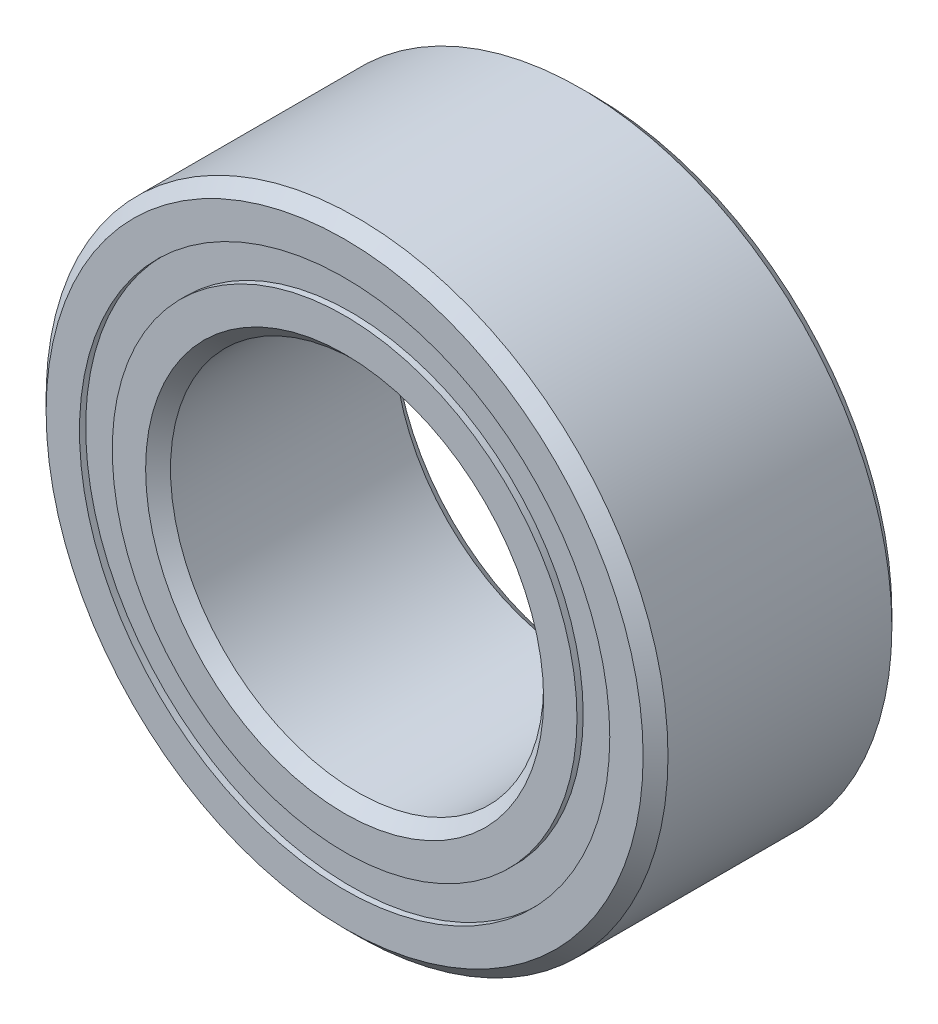
from build123d import *

# Parameters (mm, degrees)
CIRPATTERN1_COUNT = 12
SKETCH6_W         = 0.772168375
SKETCH6_H         = 0.418681318


with BuildPart() as part:
    # Sketch1 → Revolve1 (revolve)
    with BuildSketch(Plane(origin=(0, 0, 0), x_dir=(0, 0, -1), z_dir=(1, 0, 0))):
        with BuildLine():
            Line((1.42875, 3.96875), (-1.42875, 3.96875))
            Line((-1.42875, 3.96875), (-1.5875, 3.81))
            Line((-1.5875, 3.81), (-1.5875, 3.384340659))
            Line((-1.5875, 3.384340659), (-0.705555556, 3.384340659))
            ThreePointArc((-0.705555556, 3.384340659), (0, 3.910956625), (0.705555556, 3.384340659))
            Line((0.705555556, 3.384340659), (1.5875, 3.384340659))
            Line((1.5875, 3.384340659), (1.5875, 3.81))
            Line((1.5875, 3.81), (1.42875, 3.96875))
        make_face()
    revolve(axis=Axis((0, 0, 1.5875), (0, 0, -1)))


with BuildPart() as body_2:
    # Sketch3 → Revolve3 (revolve)
    with BuildSketch(Plane(origin=(0, 0, 0), x_dir=(0, 0, -1), z_dir=(1, 0, 0))):
        with BuildLine():
            Line((-1.5875, 2.965659341), (-0.705555556, 2.965659341))
            ThreePointArc((-0.705555556, 2.965659341), (0, 2.439043375), (0.705555556, 2.965659341))
            Line((0.705555556, 2.965659341), (1.5875, 2.965659341))
            Line((1.5875, 2.965659341), (1.5875, 2.54))
            Line((1.5875, 2.54), (1.42875, 2.38125))
            Line((1.42875, 2.38125), (-1.42875, 2.38125))
            Line((-1.42875, 2.38125), (-1.5875, 2.54))
            Line((-1.5875, 2.54), (-1.5875, 2.965659341))
        make_face()
    revolve(axis=Axis((0, 0, 1.5875), (0, 0, -1)))


with BuildPart() as body_3:
    # Sketch4 → Revolve4 (revolve)
    with BuildSketch(Plane(origin=(0, 0, 0), x_dir=(0, 0, -1), z_dir=(1, 0, 0))):
        with BuildLine():
            Line((-0.735956625, 3.175), (0.735956625, 3.175))
            ThreePointArc((0.735956625, 3.175), (0, 3.910956625), (-0.735956625, 3.175))
        make_face()
    revolve(axis=Axis((0, 3.175, 0.735956625), (0, 0, -1)))


with BuildPart() as cirpattern1_1:
    # CirPattern1: pattern copy
    add(body_3.part.rotate(Axis((0, 0, -1.5875), (0, 0, 1)), 1 * 360 / CIRPATTERN1_COUNT))


with BuildPart() as cirpattern1_2:
    # CirPattern1: pattern copy
    add(body_3.part.rotate(Axis((0, 0, -1.5875), (0, 0, 1)), 2 * 360 / CIRPATTERN1_COUNT))


with BuildPart() as cirpattern1_3:
    # CirPattern1: pattern copy
    add(body_3.part.rotate(Axis((0, 0, -1.5875), (0, 0, 1)), 3 * 360 / CIRPATTERN1_COUNT))


with BuildPart() as cirpattern1_4:
    # CirPattern1: pattern copy
    add(body_3.part.rotate(Axis((0, 0, -1.5875), (0, 0, 1)), 4 * 360 / CIRPATTERN1_COUNT))


with BuildPart() as cirpattern1_5:
    # CirPattern1: pattern copy
    add(body_3.part.rotate(Axis((0, 0, -1.5875), (0, 0, 1)), 5 * 360 / CIRPATTERN1_COUNT))


with BuildPart() as cirpattern1_6:
    # CirPattern1: pattern copy
    add(body_3.part.rotate(Axis((0, 0, -1.5875), (0, 0, 1)), 6 * 360 / CIRPATTERN1_COUNT))


with BuildPart() as cirpattern1_7:
    # CirPattern1: pattern copy
    add(body_3.part.rotate(Axis((0, 0, -1.5875), (0, 0, 1)), 7 * 360 / CIRPATTERN1_COUNT))


with BuildPart() as cirpattern1_8:
    # CirPattern1: pattern copy
    add(body_3.part.rotate(Axis((0, 0, -1.5875), (0, 0, 1)), 8 * 360 / CIRPATTERN1_COUNT))


with BuildPart() as cirpattern1_9:
    # CirPattern1: pattern copy
    add(body_3.part.rotate(Axis((0, 0, -1.5875), (0, 0, 1)), 9 * 360 / CIRPATTERN1_COUNT))


with BuildPart() as cirpattern1_10:
    # CirPattern1: pattern copy
    add(body_3.part.rotate(Axis((0, 0, -1.5875), (0, 0, 1)), 10 * 360 / CIRPATTERN1_COUNT))


with BuildPart() as cirpattern1_11:
    # CirPattern1: pattern copy
    add(body_3.part.rotate(Axis((0, 0, -1.5875), (0, 0, 1)), 11 * 360 / CIRPATTERN1_COUNT))


with BuildPart() as body_15:
    # Sketch6 → Revolve5 (revolve)
    with BuildSketch(Plane(origin=(0, 0, 0), x_dir=(0, 0, -1), z_dir=(1, 0, 0))):
        with Locations((-1.122040813, 3.175)):
            Rectangle(SKETCH6_W, SKETCH6_H)
        with Locations((1.122040813, 3.175)):
            Rectangle(SKETCH6_W, SKETCH6_H)
    revolve(axis=Axis((0, 0, 1.5875), (0, 0, -1)))


solid = Compound([part.part, body_2.part, body_3.part, cirpattern1_1.part, cirpattern1_2.part, cirpattern1_3.part, cirpattern1_4.part, cirpattern1_5.part, cirpattern1_6.part, cirpattern1_7.part, cirpattern1_8.part, cirpattern1_9.part, cirpattern1_10.part, cirpattern1_11.part, body_15.part])
